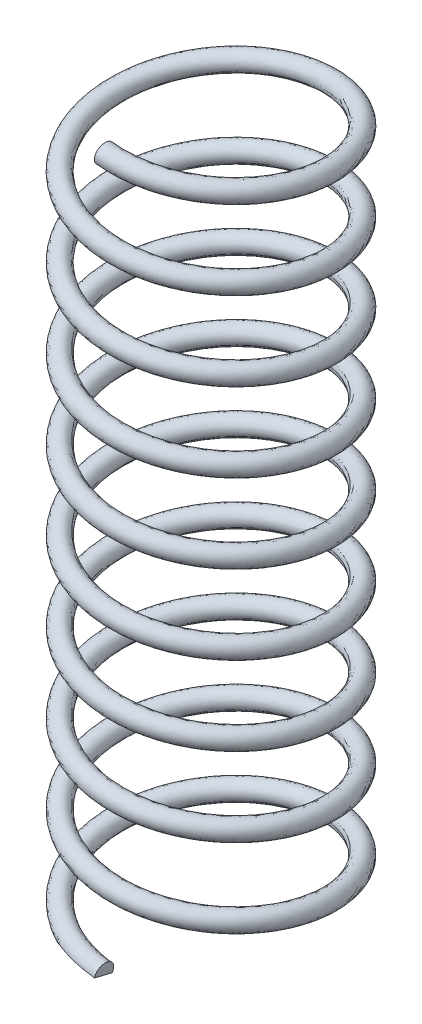
from build123d import *

# Parameters (mm, degrees)
BALAYAGE1_PITCH         = 49.444444444
BALAYAGE1_HEIGHT        = 445
BALAYAGE1_RADIUS        = 67
BALAYAGE1_PROFILE_R     = 6
ENL_V_MAT_EXTRU_1_DEPTH = 30


with BuildPart() as part:
    # Balayage1: sweep along a helix
    with BuildLine() as balayage1_path:
        Helix(BALAYAGE1_PITCH, BALAYAGE1_HEIGHT, BALAYAGE1_RADIUS, center=(67, 0, 0), direction=(0, 1, 0), lefthand=True)
    # Balayage1 profile (on start of the path) → Balayage1 (sweep)
    with BuildSketch(Plane(origin=(67, 0, 67), x_dir=(-0.1166508025565578, -0.9931729911062377, 0), z_dir=(-0.9931729911062377, 0.1166508025565578, -1.722037487515905e-14))):
        Circle(BALAYAGE1_PROFILE_R)
    sweep(path=balayage1_path.line, is_frenet=True)

    # Esquisse5 → Enlèv. mat.-Extru.1 (cut)
    with BuildSketch(Plane(origin=(66.088303548, -7.762246575, 0), x_dir=(0, 0, -1), z_dir=(0.9931729911062456, -0.11665080255649109, -1.7473319603985343e-14))):
        Polygon((-74.341070721, 8.665455261), (-61, 5.127408284), (-59.900062652, 1.228336106), (-71.99440691, 0.722900823), align=None)
    extrude(amount=-ENL_V_MAT_EXTRU_1_DEPTH, mode=Mode.SUBTRACT)


solid = part.part
